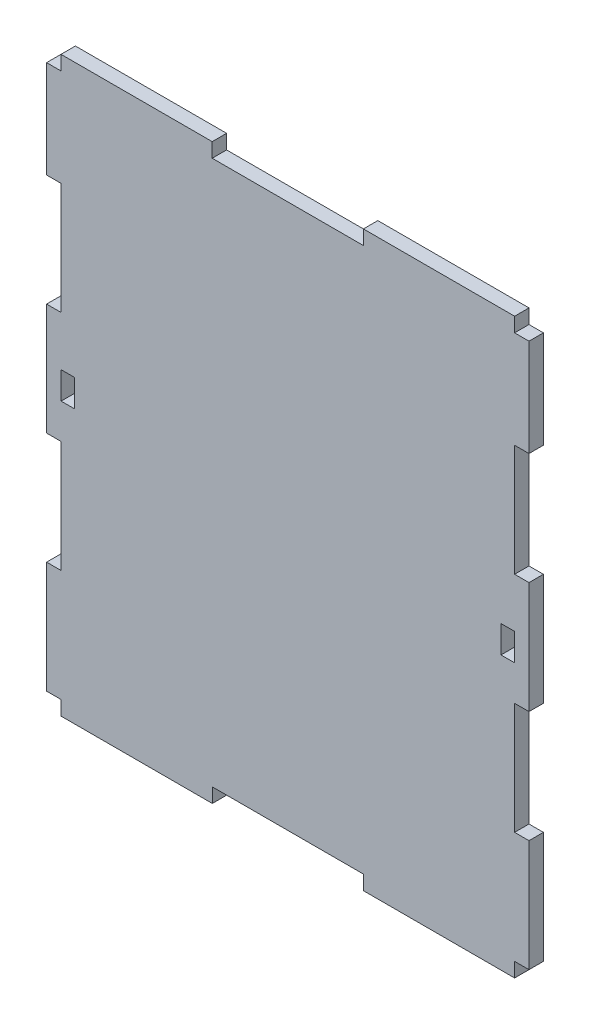
from build123d import *

# Parameters (mm, degrees)
SKETCH1_W           = 3
SKETCH1_H           = 6
BOSS_EXTRUDE1_DEPTH = 3.175


with BuildPart() as part:
    # Sketch1 → Boss-Extrude1 (new body)
    with BuildSketch(Plane.XY):
        Polygon((0, 120), (-3.175, 120), (-3.175, 98.54), (0, 98.54), (0, 73.905), (-3.175, 73.905), (-3.175, 49.27), (0, 49.27), (0, 24.635), (-3.175, 24.635), (-3.175, 0), (0, 0), (0, -3.175), (33.358811077, -3.175), (33.358811077, 0), (66.692144411, 0), (66.692144411, -3.175), (100, -3.175), (100, 0), (103.175, 0), (103.175, 24.635), (100, 24.635), (100, 49.27), (103.175, 49.27), (103.175, 73.905), (100, 73.905), (100, 98.54), (103.175, 98.54), (103.175, 120), (100, 120), (100, 123.175), (66.666666667, 123.175), (66.666666667, 120), (33.333333333, 120), (33.333333333, 123.175), (0, 123.175), align=None)
        with Locations((98.5, 60)):
            Rectangle(SKETCH1_W, SKETCH1_H, mode=Mode.SUBTRACT)
        Polygon((3.024208093, 62.980047574), (3.026755867, 56.980048114), (0.026756138, 56.978774227), (0.024208364, 62.978773686), align=None, mode=Mode.SUBTRACT)
    extrude(amount=BOSS_EXTRUDE1_DEPTH)


solid = part.part
